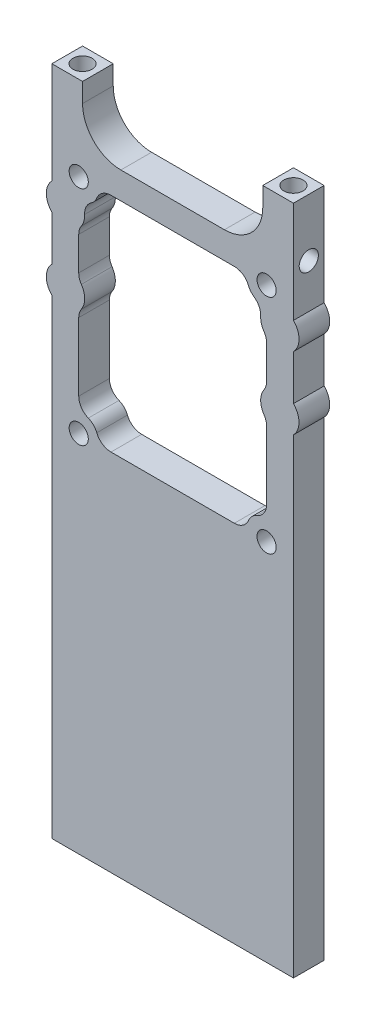
from build123d import *

# Parameters (mm, degrees)
EXTRUDE_1_DEPTH     = 8
SKETCH_2_R          = 2.5
CUT_EXTRUDE_1_DEPTH = 6
SKETCH_3_R          = 2.5
CUT_EXTRUDE_2_DEPTH = 6
FILLET_1_R          = 10
SKETCH_4_W          = 39
SKETCH_4_H          = 48
SKETCH_4_W_2        = 5
SKETCH_4_H_2        = 5
CUT_EXTRUDE_3_DEPTH = 21
SKETCH_5_R          = 5
EXTRUDE_2_DEPTH     = 8
FILLET_2_R          = 4
FILLET_3_R          = 4
SKETCH_6_R          = 2.5
CUT_EXTRUDE_4_DEPTH = 6
SKETCH_7_R          = 2.5
CUT_EXTRUDE_5_DEPTH = 6


with BuildPart() as part:
    # Эскиз1 → Бобышка-Вытянуть1 (new body)
    with BuildSketch(Plane.XY):
        Polygon((-23.5, 72.5), (-23.5, 87.5), (-31.5, 87.5), (-31.5, -87.5), (31.5, -87.5), (31.5, 87.5), (23.5, 87.5), (23.5, 72.5), align=None)
    extrude(amount=EXTRUDE_1_DEPTH)

    # Эскиз2 → Вырез-Вытянуть1 (cut)
    with BuildSketch(Plane(origin=(0, 87.5, 0), x_dir=(1, 0, 0), z_dir=(0, 1, 0))):
        with Locations(Location((-27.5, -4, 0), (0, 0, 180))):
            Circle(SKETCH_2_R)
        with Locations((27.5, -4)):
            Circle(SKETCH_2_R)
    extrude(amount=-CUT_EXTRUDE_1_DEPTH, mode=Mode.SUBTRACT)

    # Эскиз3 → Вырез-Вытянуть2 (cut)
    with BuildSketch(Plane.XY.offset(8)):
        with Locations((-24.5, 65.5)):
            Circle(SKETCH_3_R)
        with Locations((24.5, 65.5)):
            Circle(SKETCH_3_R)
        with Locations((24.5, 7.5)):
            Circle(SKETCH_3_R)
        with Locations((-24.5, 7.5)):
            Circle(SKETCH_3_R)
    extrude(amount=-CUT_EXTRUDE_2_DEPTH, mode=Mode.SUBTRACT)

    # Скругление1
    fillet_1_edges = [part.edges().sort_by_distance(p)[0] for p in [
        (-23.5, 72.5, 4),
        (23.5, 72.5, 4),
    ]]
    fillet(fillet_1_edges, radius=FILLET_1_R)

    # Эскиз4 → Вырез-Вытянуть3 (cut)
    with BuildSketch(Plane.XY.offset(8)):
        with Locations((0, 36.5)):
            Rectangle(SKETCH_4_W, SKETCH_4_H)
        with Locations((-22, 36.5)):
            Rectangle(SKETCH_4_W_2, SKETCH_4_H)
        with Locations((0, 63)):
            Rectangle(SKETCH_4_W, SKETCH_4_H_2)
        with Locations((22, 36.5)):
            Rectangle(SKETCH_4_W_2, SKETCH_4_H)
        with Locations((0, 10)):
            Rectangle(SKETCH_4_W, SKETCH_4_H_2)
    extrude(amount=-CUT_EXTRUDE_3_DEPTH, mode=Mode.SUBTRACT)

    # Эскиз5 → Бобышка-Вытянуть2 (add)
    with BuildSketch(Plane(origin=(0, 0, 0), x_dir=(-1, 0, 0), z_dir=(0, 0, -1))):
        with Locations((-27.95, 57.5)):
            Circle(SKETCH_5_R)
        with Locations((-27.95, 38.7)):
            Circle(SKETCH_5_R)
        with Locations((27.95, 38.7)):
            Circle(SKETCH_5_R)
        with Locations((27.95, 57.5)):
            Circle(SKETCH_5_R)
    extrude(amount=-EXTRUDE_2_DEPTH)

    # Скругление2
    fillet_2_edges = [part.edges().sort_by_distance(p)[0] for p in [
        (-19.5, 12.5, 4),
        (-19.5, 60.5, 4),
        (19.5, 60.5, 4),
        (19.5, 12.5, 4),
    ]]
    fillet(fillet_2_edges, radius=FILLET_2_R)

    # Скругление3
    fillet_3_edges = [part.edges().sort_by_distance(p)[0] for p in [
        (-24.5, 42.319046836, 4),
        (-24.5, 35.080953164, 4),
        (-24.5, 53.880953164, 4),
        (-23.95, 60.5, 4),
        (-19.5, 65.5, 4),
        (24.5, 42.319046836, 4),
        (24.5, 35.080953164, 4),
        (24.5, 53.880953164, 4),
        (19.5, 65.5, 4),
        (23.95, 60.5, 4),
        (24.5, 12.5, 4),
        (19.5, 7.5, 4),
        (-19.5, 7.5, 4),
        (-24.5, 12.5, 4),
    ]]
    fillet(fillet_3_edges, radius=FILLET_3_R)

    # Эскиз6 → Вырез-Вытянуть4 (cut)
    with BuildSketch(Plane(origin=(0, 0, 0), x_dir=(-1, 0, 0), z_dir=(0, 0, -1))):
        with Locations((-27.95, 57.5)):
            Circle(SKETCH_6_R)
        with Locations((27.95, 57.5)):
            Circle(SKETCH_6_R)
        with Locations((27.95, 38.7)):
            Circle(SKETCH_6_R)
        with Locations((-27.95, 38.7)):
            Circle(SKETCH_6_R)
    extrude(amount=-CUT_EXTRUDE_4_DEPTH, mode=Mode.SUBTRACT)

    # Эскиз7 → Вырез-Вытянуть5 (cut)
    with BuildSketch(Plane.ZY.offset(31.5)):
        with Locations((4, 72.5)):
            Circle(SKETCH_7_R)
    cut_extrude_5 = extrude(amount=-CUT_EXTRUDE_5_DEPTH, mode=Mode.SUBTRACT)

    # Зеркальное отражение1: Вырез-Вытянуть5 across plane
    add(cut_extrude_5.mirror(Plane(origin=(0, 0, 0), x_dir=(0, 0, 1), z_dir=(1, 0, 0))), mode=Mode.SUBTRACT)


solid = part.part
